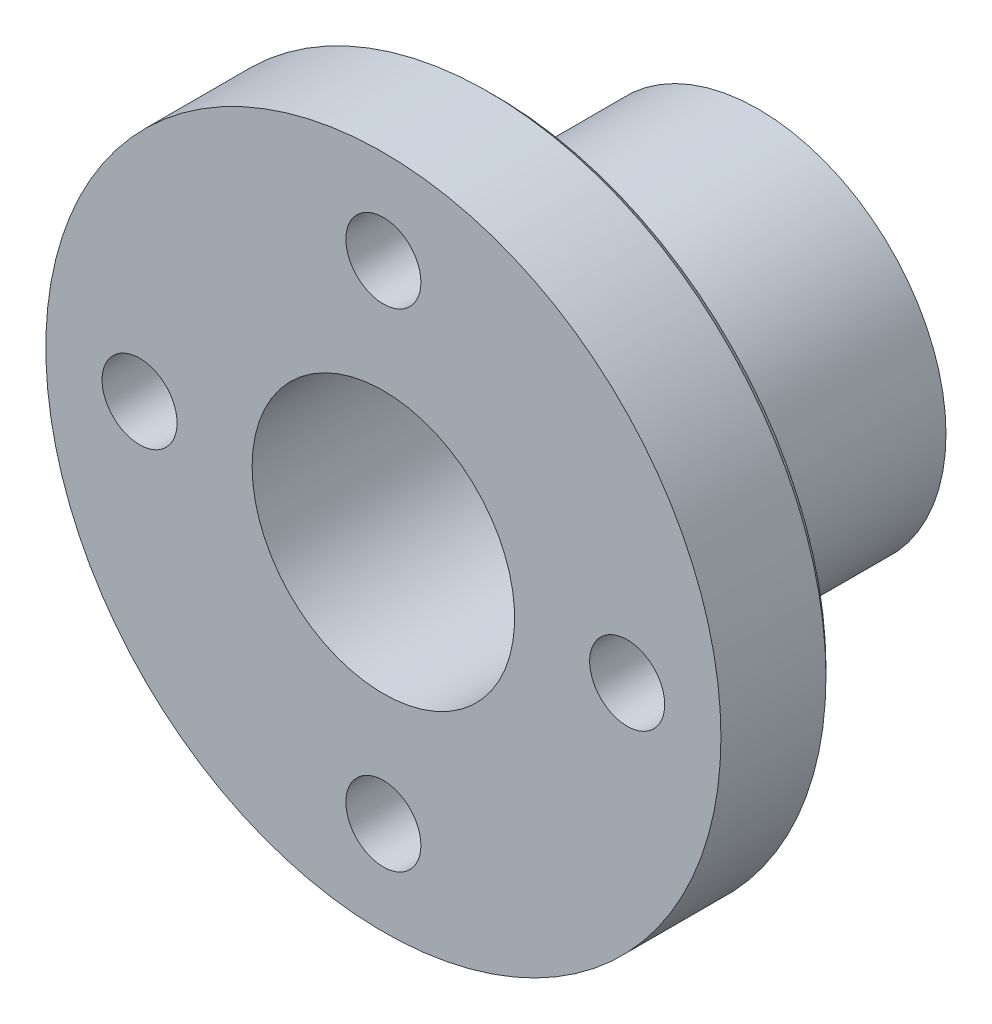
from build123d import *

# Parameters (mm, degrees)
SKETCH1_R           = 45
SKETCH1_R_2         = 5
BOSS_EXTRUDE1_DEPTH = 15
SKETCH3_R           = 25
BOSS_EXTRUDE2_DEPTH = 35
FILLET1_R           = 1
CHAMFER1_SIZE       = 1
SKETCH4_R           = 17.5
CUT_EXTRUDE1_DEPTH  = 59


with BuildPart() as part:
    # Sketch1 → Boss-Extrude1 (new body)
    with BuildSketch(Plane.XY):
        Circle(SKETCH1_R)
        with Locations((0, 32.5)):
            Circle(SKETCH1_R_2, mode=Mode.SUBTRACT)
        with Locations((32.5, 0)):
            Circle(SKETCH1_R_2, mode=Mode.SUBTRACT)
        with Locations((0, -32.5)):
            Circle(SKETCH1_R_2, mode=Mode.SUBTRACT)
        with Locations((-32.5, 0)):
            Circle(SKETCH1_R_2, mode=Mode.SUBTRACT)
    extrude(amount=-BOSS_EXTRUDE1_DEPTH)

    # Sketch3 → Boss-Extrude2 (add)
    with BuildSketch(Plane(origin=(0, 0, -15), x_dir=(-1, 0, 0), z_dir=(0, 0, -1))):
        with Locations(Location((0, 0, 0), (0, 0, 180))):
            Circle(SKETCH3_R)
    extrude(amount=BOSS_EXTRUDE2_DEPTH)

    # Fillet1
    fillet1_edges = [part.edges().sort_by_distance(p)[0] for p in [
        (-25, 0, -15),
    ]]
    fillet(fillet1_edges, radius=FILLET1_R)

    # Chamfer1
    chamfer1_edges = [part.edges().sort_by_distance(p)[0] for p in [
        (-45, 0, -15),
    ]]
    chamfer(chamfer1_edges, length=CHAMFER1_SIZE)

    # Sketch4 → Cut-Extrude1 (cut)
    with BuildSketch(Plane(origin=(0, 0, -50), x_dir=(-1, 0, 0), z_dir=(0, 0, -1))):
        Circle(SKETCH4_R)
    extrude(amount=-CUT_EXTRUDE1_DEPTH, mode=Mode.SUBTRACT)


solid = part.part
